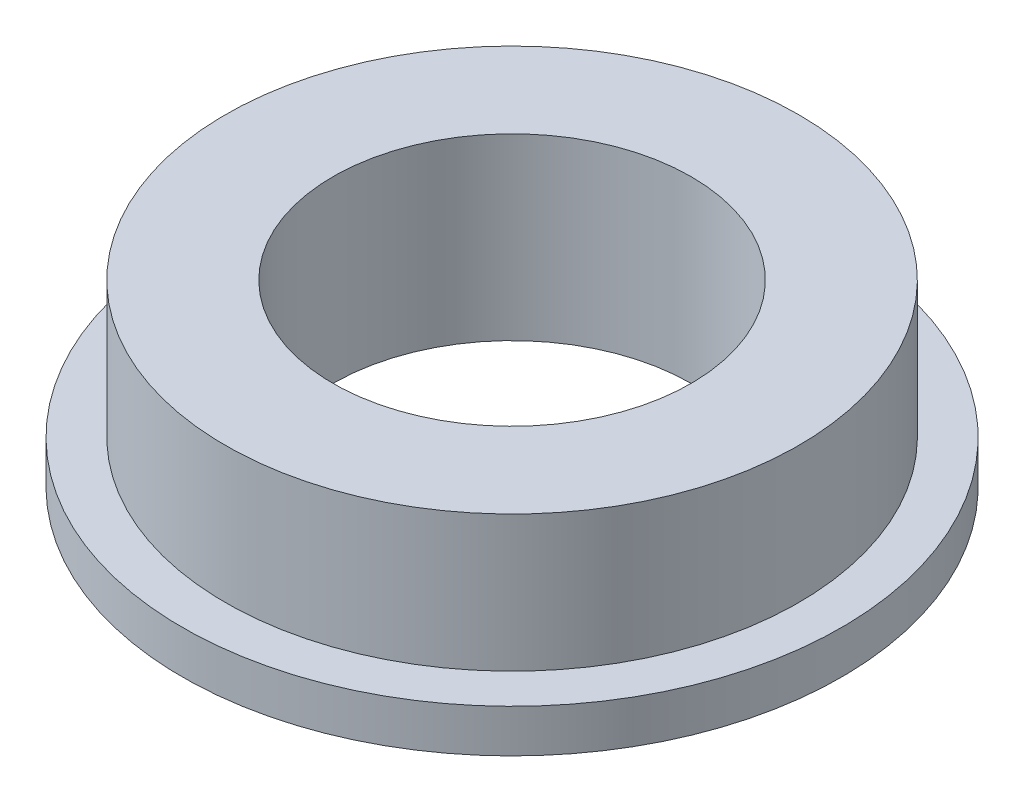
from build123d import *


with BuildPart() as part:
    # Sketch1 → Revolve1 (revolve)
    with BuildSketch(Plane.XY, mode=Mode.PRIVATE) as revolve1_sk:
        Polygon((2.5, 0), (2.5, 2.5), (4, 2.5), (4, 0.6), (4.6, 0.6), (4.6, 0), align=None)
    revolve(revolve1_sk.sketch.rotate(Axis((0, 0, 0), (0, 1, 0)), 90), axis=Axis((0, 0, 0), (0, 1, 0)))


solid = part.part
